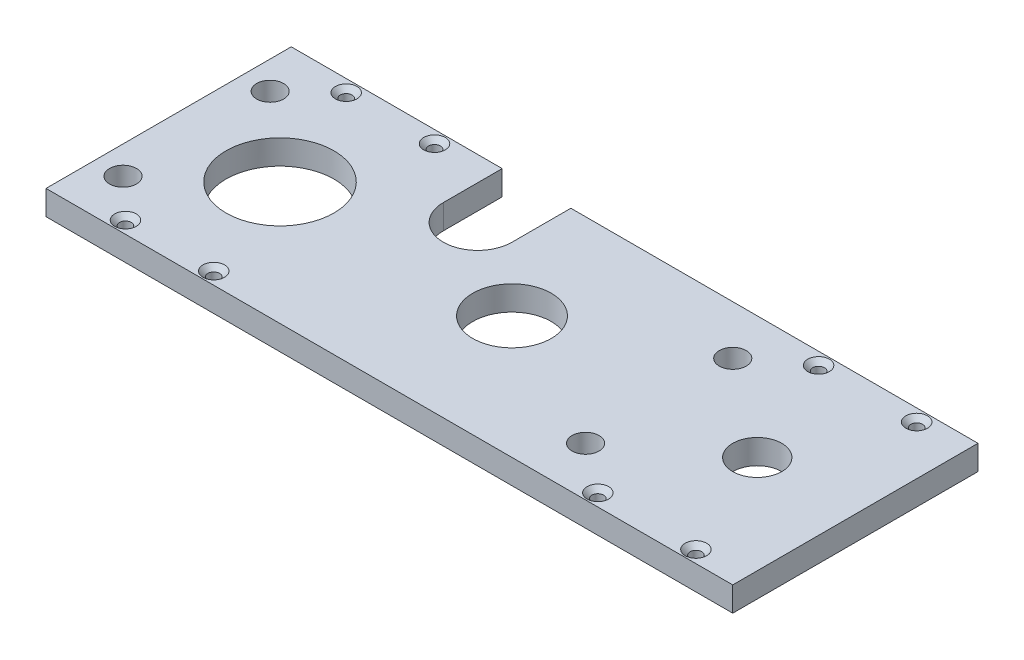
from build123d import *

# Parameters (mm, degrees)
SKETCH1_W                                           = 140
SKETCH1_H                                           = 50
SKETCH1_R                                           = 5
BOSS_EXTRUDE2_DEPTH                                 = 5
CUT_EXTRUDE1_REACH                                  = 108.596
SKETCH5_R                                           = 8
CUT_EXTRUDE2_REACH                                  = 108.596
SKETCH14_R                                          = 11
CSK_FOR_M2_COUNTERSUNK_FLAT_HEAD_SCREW1_D           = 2.4
CSK_FOR_M2_COUNTERSUNK_FLAT_HEAD_SCREW1_CSINK_D     = 4.4
CSK_FOR_M2_COUNTERSUNK_FLAT_HEAD_SCREW1_CSINK_ANGLE = 90
M5_CLEARANCE_HOLE1_D                                = 5.5
M5_CLEARANCE_HOLE1_DEPTH                            = 19.75
M5_CLEARANCE_HOLE1_TIP                              = 1.652366702
CUT_EXTRUDE3_DEPTH                                  = 107.595732004


with BuildPart() as part:
    # Sketch1 → Boss-Extrude2 (new body)
    with BuildSketch(Plane(origin=(0, 0, 0), x_dir=(1, 0, 0), z_dir=(0, 1, 0))):
        with Locations((-33.501932743, 0)):
            Rectangle(SKETCH1_W, SKETCH1_H)
        with Locations(Location((16.498067257, 0, 0), (0, 0, 270))):
            Circle(SKETCH1_R, mode=Mode.SUBTRACT)
    extrude(amount=BOSS_EXTRUDE2_DEPTH)

    # Sketch5 → Cut-Extrude1 (cut, up to next)
    with BuildSketch(Plane.XZ, mode=Mode.PRIVATE) as cut_extrude1_sk1:
        with Locations(Location((-33.501932743, 0, 0), (0, 0, 270))):
            Circle(SKETCH5_R)
    cut_extrude1_tool1 = extrude(cut_extrude1_sk1.sketch, amount=-CUT_EXTRUDE1_REACH, mode=Mode.PRIVATE) & part.part
    add(cut_extrude1_tool1.solids().sort_by_distance((-33.501933, 0, 0))[0], mode=Mode.SUBTRACT)

    # Sketch14 → Cut-Extrude2 (cut, up to next)
    with BuildSketch(Plane(origin=(0, 5, 0), x_dir=(1, 0, 0), z_dir=(0, 1, 0)), mode=Mode.PRIVATE) as cut_extrude2_sk1:
        with Locations(Location((-80.801932743, 0, 0), (0, 0, 270))):
            Circle(SKETCH14_R)
    cut_extrude2_tool1 = extrude(cut_extrude2_sk1.sketch, amount=-CUT_EXTRUDE2_REACH, mode=Mode.PRIVATE) & part.part
    add(cut_extrude2_tool1.solids().sort_by_distance((-80.801933, 5, 0))[0], mode=Mode.SUBTRACT)

    # CSK for M2 Countersunk Flat Head Screw1 (through all)
    with Locations(Plane(origin=(0, 5, 0), x_dir=(1, 0, 0), z_dir=(0, 1, 0))):
        with Locations((-89.801932743, 22.5), (-71.801932743, 22.5), (-71.801932743, -22.5), (-89.801932743, -22.5), (6.498067257, 22.5), (26.498067257, 22.5), (6.498067257, -22.5), (26.498067257, -22.5)):
            CounterSinkHole(CSK_FOR_M2_COUNTERSUNK_FLAT_HEAD_SCREW1_D / 2, CSK_FOR_M2_COUNTERSUNK_FLAT_HEAD_SCREW1_CSINK_D / 2, counter_sink_angle=CSK_FOR_M2_COUNTERSUNK_FLAT_HEAD_SCREW1_CSINK_ANGLE)

    # M5 Clearance Hole1
    with Locations(Plane(origin=(0, 0, 0), x_dir=(-1, 0, 0), z_dir=(0, -1, 0))):
        with Locations((97.801932743, 15), (97.801932743, -15), (3.501932743, -15), (3.501932743, 15)):
            Hole(M5_CLEARANCE_HOLE1_D / 2, depth=M5_CLEARANCE_HOLE1_DEPTH)
            with Locations((0, 0, -(M5_CLEARANCE_HOLE1_DEPTH + M5_CLEARANCE_HOLE1_TIP / 2))):  # 118° drill point
                Cone(0, M5_CLEARANCE_HOLE1_D / 2, M5_CLEARANCE_HOLE1_TIP, mode=Mode.SUBTRACT)

    # Sketch20 → Cut-Extrude3 (cut, through all)
    with BuildSketch(Plane(origin=(0, 0, 0), x_dir=(-1, 0, 0), z_dir=(0, -1, 0))):
        with BuildLine():
            Line((46.501932743, 13), (46.501932743, 25))
            ThreePointArc((46.501932743, 25), (53.501932743, 32), (60.501932743, 25))
            Line((60.501932743, 25), (60.501932743, 13))
            ThreePointArc((60.501932743, 13), (53.501932743, 6), (46.501932743, 13))
        make_face()
    extrude(amount=-CUT_EXTRUDE3_DEPTH, mode=Mode.SUBTRACT)


solid = part.part
